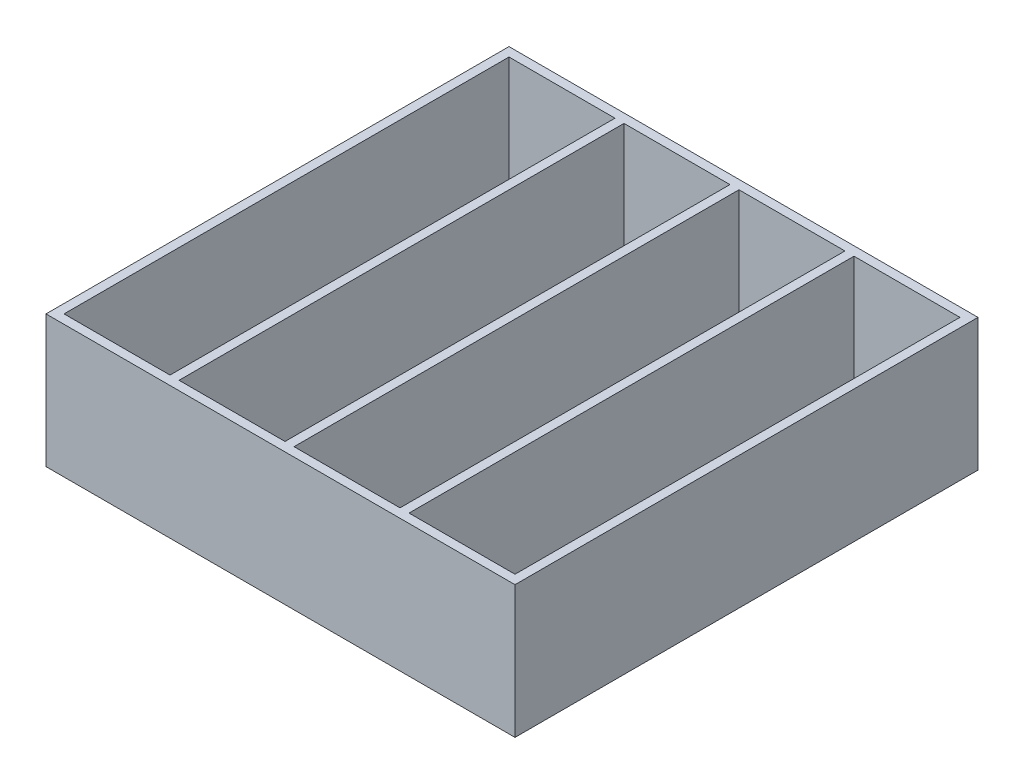
from build123d import *

# Parameters (mm, degrees)
SKETCH1_W           = 78
SKETCH1_H           = 77
BOSS_EXTRUDE1_DEPTH = 22
SKETCH3_W           = 17.625
SKETCH3_H           = 74
CUT_EXTRUDE1_DEPTH  = 20


with BuildPart() as part:
    # Sketch1 → Boss-Extrude1 (new body)
    with BuildSketch(Plane(origin=(0, 0, 0), x_dir=(1, 0, 0), z_dir=(0, 1, 0))):
        with Locations((-39, -38.5)):
            Rectangle(SKETCH1_W, SKETCH1_H)
    extrude(amount=BOSS_EXTRUDE1_DEPTH)

    # Sketch3 → Cut-Extrude1 (cut)
    with BuildSketch(Plane(origin=(0, 22, 0), x_dir=(1, 0, 0), z_dir=(0, 1, 0))):
        with Locations((-67.6875, -38.5)):
            Rectangle(SKETCH3_W, SKETCH3_H)
        with Locations((-48.5625, -38.5)):
            Rectangle(SKETCH3_W, SKETCH3_H)
        with Locations((-29.4375, -38.5)):
            Rectangle(SKETCH3_W, SKETCH3_H)
        with Locations((-10.3125, -38.5)):
            Rectangle(SKETCH3_W, SKETCH3_H)
    extrude(amount=-CUT_EXTRUDE1_DEPTH, mode=Mode.SUBTRACT)


solid = part.part
